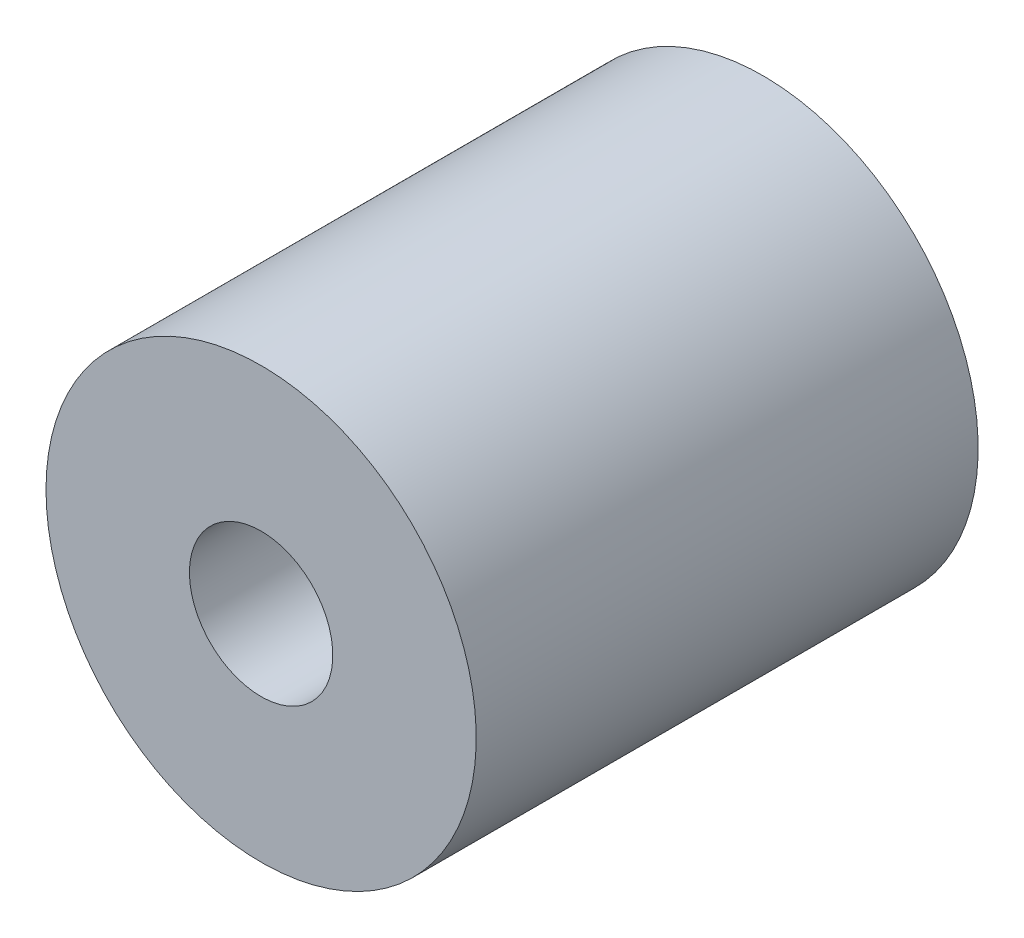
from build123d import *

# Parameters (mm, degrees)
ANNULUSPROFILE_W = 4
ANNULUSPROFILE_H = 14


with BuildPart() as part:
    # AnnulusProfile → Revolution (revolve)
    with BuildSketch(Plane(origin=(0, 0, 0), x_dir=(1, 0, 0), z_dir=(0, 1, 0)), mode=Mode.PRIVATE) as revolution_sk:
        with Locations((4, -7)):
            Rectangle(ANNULUSPROFILE_W, ANNULUSPROFILE_H)
    revolve(revolution_sk.sketch.rotate(Axis((0, 0, 0), (0, 0, 1)), 180), axis=Axis((0, 0, 0), (0, 0, 1)))


solid = part.part
